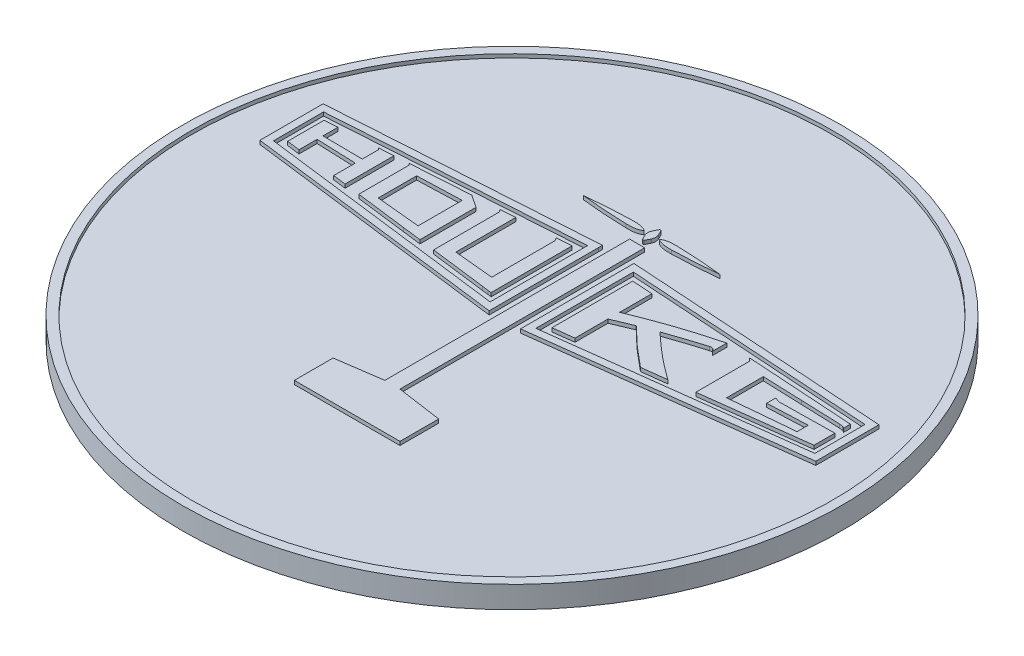
from build123d import *

# Parameters (mm, degrees)
SKETCH_3_R      = 36
SKETCH_3_R_2    = 35
EXTRUDE_2_DEPTH = 0.4
EXTRUDE_START   = 2
SKETCH_10_R     = 36
EXTRUDE_3_DEPTH = 2


with BuildPart() as part:
    # 草图3 → 凸台-拉伸2 (new body)
    # profile 1 of 14: a face of its own
    with BuildSketch(Plane(origin=(0, 0, 0), x_dir=(1, 0, 0), z_dir=(0, 1, 0))):
        with Locations(Location((0, 11.553808305, 0), (0, 0, 270))):
            Circle(SKETCH_3_R)
        with Locations(Location((0, 11.553808305, 0), (0, 0, 270))):
            Circle(SKETCH_3_R_2, mode=Mode.SUBTRACT)
    # profile 2 of 14: a face of its own
    with BuildSketch(Plane(origin=(0, 0, 0), x_dir=(1, 0, 0), z_dir=(0, 1, 0))):
        Polygon((0.86, -2.083132141), (-0.792362244, -2.083132141), (-0.792362244, -1.545326432), (-5.733618075, -2.256312599), (-5.733714019, -6.486617075), (0.033818878, -6.486617075), (5.801447721, -6.486617075), (5.801351776, -2.256312599), (0.86, -1.54532545), align=None)
    # profile 3 of 14: a face of its own
    with BuildSketch(Plane(origin=(0, 0, 0), x_dir=(1, 0, 0), z_dir=(0, 1, 0))):
        Polygon((-0.792362244, -1.545326432), (-0.792362244, -2.083132141), (0.86, -2.083132141), (0.86, -1.54532545), (0.481497558, -1.490864569), (0.033818878, -0.951366665), (-0.413859802, -1.490864569), align=None)
    # profile 4 of 14: a face of its own
    with BuildSketch(Plane(origin=(0, 0, 0), x_dir=(1, 0, 0), z_dir=(0, 1, 0))):
        Polygon((-0.792362244, 25.188808305), (-0.792362244, -1.545326432), (-0.413859802, -1.490864569), (0.033818878, -0.951366665), (0.481497558, -1.490864569), (0.86, -1.54532545), (0.86, 25.188808305), align=None)
    # profile 5 of 14: a face of its own
    with BuildSketch(Plane(origin=(0, 0, 0), x_dir=(1, 0, 0), z_dir=(0, 1, 0))):
        with BuildLine():
            add(Edge.make_bspline(
                [(-2.444724488, 26.454320905), (-4.192839694, 26.473701765), (-5.797421401, 26.62922837), (-7.401907164, 26.78485092)],
                knots=[0.6, 0.6, 0.6, 0.6, 1, 1, 1, 1], degree=3))
            add(Edge.make_bspline(
                [(-7.401907164, 26.78485092), (-5.797421401, 26.940377526), (-4.192839694, 27.096000076), (-2.444724488, 27.115284991)],
                knots=[0, 0, 0, 0, 0.2, 0.2, 0.2, 0.2], degree=3))
            add(Edge.make_bspline(
                [(-2.444724488, 27.115284991), (-1.851785301, 27.121905186), (-1.2423436, 27.112790425), (-0.792362244, 26.78485092)],
                knots=[0.2, 0.2, 0.2, 0.2, 0.4, 0.4, 0.4, 0.4], degree=3))
            add(Edge.make_bspline(
                [(-0.792362244, 26.78485092), (-1.2423436, 26.456911416), (-1.851785301, 26.447796655), (-2.444724488, 26.454320905)],
                knots=[0.4, 0.4, 0.4, 0.4, 0.6, 0.6, 0.6, 0.6], degree=3))
        make_face()
    # profile 6 of 14: a face of its own
    with BuildSketch(Plane(origin=(0, 0, 0), x_dir=(1, 0, 0), z_dir=(0, 1, 0))):
        with BuildLine():
            add(Edge.make_bspline(
                [(-30.327257972, 21.245858661), (-20.778730341, 21.870939372), (-11.230298655, 22.496116029), (-1.681866968, 23.121484575)],
                knots=[0.5, 0.5, 0.5, 0.5, 0.666666667, 0.666666667, 0.666666667, 0.666666667], degree=3))
            Line((-1.681866968, 23.121484575), (-1.681771023, 22.700094785))
            Line((-1.681771023, 22.700094785), (-1.676590001, 10.734140658))
            Line((-1.676590001, 10.734140658), (-30.327257972, 14.343394107))
            Line((-30.327257972, 14.343394107), (-30.327257972, 21.245858661))
        make_face()
        Polygon((-29.536192666, 15.037459167), (-2.464872907, 11.627195342), (-2.469478259, 22.278800939), (-29.536192666, 20.50650763), align=None, mode=Mode.SUBTRACT)
    # profile 7 of 14: a face of its own
    with BuildSketch(Plane(origin=(0, 0, 0), x_dir=(1, 0, 0), z_dir=(0, 1, 0))):
        with BuildLine():
            add(Edge.make_bspline(
                [(30.394895728, 14.343394107), (20.844737035, 13.140245661), (11.294482396, 11.937097215), (1.744227757, 10.734140658)],
                knots=[0.5, 0.5, 0.5, 0.5, 0.666666667, 0.666666667, 0.666666667, 0.666666667], degree=3))
            Line((1.744227757, 10.734140658), (1.744419647, 11.180668))
            Line((1.744419647, 11.180668), (1.749600669, 23.121484575))
            add(Edge.make_bspline(
                [(1.749600669, 23.121484575), (11.298032356, 22.496116029), (20.846464042, 21.870939372), (30.394895728, 21.245858661)],
                knots=[0.166666667, 0.166666667, 0.166666667, 0.166666667, 0.333333333, 0.333333333, 0.333333333, 0.333333333], degree=3))
            Line((30.394895728, 21.245858661), (30.394895728, 14.343394107))
        make_face()
        Polygon((29.603926367, 20.50650763), (2.537116016, 22.278800939), (2.532510663, 11.627195342), (29.603926367, 15.037459167), align=None, mode=Mode.SUBTRACT)
    # profile 8 of 14: a face of its own
    with BuildSketch(Plane(origin=(0, 0, 0), x_dir=(1, 0, 0), z_dir=(0, 1, 0))):
        with BuildLine():
            Line((-3.289614856, 12.558340133), (-3.289614856, 16.799294487))
            add(Edge.make_bspline(
                [(-3.289614856, 16.799294487), (-3.289614856, 18.333164839), (-3.289614856, 19.868762198), (-3.289614856, 21.403496053)],
                knots=[0.888888889, 0.888888889, 0.888888889, 0.888888889, 1, 1, 1, 1], degree=3))
            Line((-3.289614856, 21.403496053), (-4.904462662, 21.297764826))
            add(Edge.make_bspline(
                [(-4.904462662, 21.297764826), (-4.841043115, 21.179272933), (-4.777623568, 21.060781041), (-4.711613509, 20.943152652)],
                knots=[0.055555556, 0.055555556, 0.055555556, 0.055555556, 0.111111111, 0.111111111, 0.111111111, 0.111111111], degree=3))
            add(Edge.make_bspline(
                [(-4.711613509, 20.943152652), (-4.711613509, 19.794213047), (-4.711613509, 18.645273443), (-4.711613509, 17.497197342)],
                knots=[0.111111111, 0.111111111, 0.111111111, 0.111111111, 0.166666667, 0.166666667, 0.166666667, 0.166666667], degree=3))
            add(Edge.make_bspline(
                [(-4.711613509, 17.497197342), (-4.711613509, 16.348161793), (-4.711613509, 15.200181637), (-4.711613509, 14.052105536)],
                knots=[0.166666667, 0.166666667, 0.166666667, 0.166666667, 0.222222222, 0.222222222, 0.222222222, 0.222222222], degree=3))
            add(Edge.make_bspline(
                [(-4.711613509, 14.052105536), (-6.159325384, 14.191129626), (-7.604446747, 14.329194269), (-9.04956811, 14.467258911)],
                knots=[0.222222222, 0.222222222, 0.222222222, 0.222222222, 0.277777778, 0.277777778, 0.277777778, 0.277777778], degree=3))
            add(Edge.make_bspline(
                [(-9.04956811, 14.467258911), (-9.04956811, 15.562853178), (-9.04956811, 16.658447444), (-9.04956811, 17.753178208)],
                knots=[0.277777778, 0.277777778, 0.277777778, 0.277777778, 0.333333333, 0.333333333, 0.333333333, 0.333333333], degree=3))
            Line((-9.04956811, 17.753178208), (-9.04956811, 21.026432784))
            Line((-9.04956811, 21.026432784), (-10.6526147, 20.921373171))
            add(Edge.make_bspline(
                [(-10.6526147, 20.921373171), (-10.592265388, 20.822645918), (-10.531820131, 20.725357838), (-10.468976253, 20.62653464)],
                knots=[0.444444444, 0.444444444, 0.444444444, 0.444444444, 0.5, 0.5, 0.5, 0.5], degree=3))
            add(Edge.make_bspline(
                [(-10.468976253, 20.62653464), (-10.468976253, 19.430582058), (-10.468976253, 18.234629476), (-10.468976253, 17.039636342)],
                knots=[0.5, 0.5, 0.5, 0.5, 0.555555556, 0.555555556, 0.555555556, 0.555555556], degree=3))
            Line((-10.468976253, 17.039636342), (-10.468976253, 13.462716309))
            Line((-10.468976253, 13.462716309), (-4.37705381, 12.695349381))
            add(Edge.make_bspline(
                [(-4.37705381, 12.695349381), (-4.145251047, 12.666469981), (-3.913448284, 12.637494636), (-3.681645522, 12.60851929)],
                knots=[0.666666667, 0.666666667, 0.666666667, 0.666666667, 0.722222222, 0.722222222, 0.722222222, 0.722222222], degree=3))
            add(Edge.make_bspline(
                [(-3.681645522, 12.60851929), (-3.674449658, 12.607559842), (-3.667349739, 12.606408503), (-3.66005793, 12.604969331)],
                knots=[0.722222222, 0.722222222, 0.722222222, 0.722222222, 0.777777778, 0.777777778, 0.777777778, 0.777777778], degree=3))
            Line((-3.66005793, 12.604969331), (-3.289614856, 12.558340133))
        make_face()
    # profile 9 of 14: a face of its own
    with BuildSketch(Plane(origin=(0, 0, 0), x_dir=(1, 0, 0), z_dir=(0, 1, 0))):
        with BuildLine():
            add(Edge.make_bspline(
                [(-12.183126981, 16.743166749), (-12.183126981, 17.762292969), (-12.183126981, 18.783338085), (-12.183126981, 19.804383202)],
                knots=[0.7, 0.7, 0.7, 0.7, 0.8, 0.8, 0.8, 0.8], degree=3))
            add(Edge.make_bspline(
                [(-12.183126981, 19.804383202), (-12.644717665, 20.119657986), (-13.106308349, 20.429559858), (-13.567994977, 20.73053886)],
                knots=[0.8, 0.8, 0.8, 0.8, 1, 1, 1, 1], degree=3))
            Line((-13.567994977, 20.73053886), (-19.998890583, 20.309436904))
            add(Edge.make_bspline(
                [(-19.998890583, 20.309436904), (-19.942187175, 20.240068775), (-19.885195933, 20.170029033), (-19.826285794, 20.100852795)],
                knots=[0.1, 0.1, 0.1, 0.1, 0.2, 0.2, 0.2, 0.2], degree=3))
            add(Edge.make_bspline(
                [(-19.826285794, 20.100852795), (-19.826285794, 19.189376699), (-19.826285794, 18.277900604), (-19.826285794, 17.366424509)],
                knots=[0.2, 0.2, 0.2, 0.2, 0.3, 0.3, 0.3, 0.3], degree=3))
            Line((-19.826285794, 17.366424509), (-19.826285794, 14.641494762))
            Line((-19.826285794, 14.641494762), (-14.247284531, 13.93869872))
            add(Edge.make_bspline(
                [(-14.247284531, 13.93869872), (-13.55974372, 13.853019967), (-12.87181913, 13.767437159), (-12.183126981, 13.681950296)],
                knots=[0.5, 0.5, 0.5, 0.5, 0.6, 0.6, 0.6, 0.6], degree=3))
            add(Edge.make_bspline(
                [(-12.183126981, 13.681950296), (-12.183126981, 14.702035964), (-12.183126981, 15.723081081), (-12.183126981, 16.743166749)],
                knots=[0.6, 0.6, 0.6, 0.6, 0.7, 0.7, 0.7, 0.7], degree=3))
        make_face()
        with BuildLine():
            add(Edge.make_bspline(
                [(-13.59236497, 19.708630239), (-15.198865574, 19.653366004), (-16.802871613, 19.597238266), (-18.406781706, 19.541974031)],
                knots=[0.714285714, 0.714285714, 0.714285714, 0.714285714, 1, 1, 1, 1], degree=3))
            add(Edge.make_bspline(
                [(-18.406781706, 19.541974031), (-18.406781706, 18.844071177), (-18.406781706, 18.144441315), (-18.406781706, 17.44653846)],
                knots=[0, 0, 0, 0, 0.142857143, 0.142857143, 0.142857143, 0.142857143], degree=3))
            add(Edge.make_bspline(
                [(-18.406781706, 17.44653846), (-18.406781706, 16.74873155), (-18.406781706, 16.049869247), (-18.406781706, 15.351102889)],
                knots=[0.142857143, 0.142857143, 0.142857143, 0.142857143, 0.285714286, 0.285714286, 0.285714286, 0.285714286], degree=3))
            add(Edge.make_bspline(
                [(-18.406781706, 15.351102889), (-16.802871613, 15.196439787), (-15.198865574, 15.042736134), (-13.59236497, 14.887113584)],
                knots=[0.285714286, 0.285714286, 0.285714286, 0.285714286, 0.428571429, 0.428571429, 0.428571429, 0.428571429], degree=3))
            add(Edge.make_bspline(
                [(-13.59236497, 14.887113584), (-13.59236497, 15.689980107), (-13.59236497, 16.494573637), (-13.59236497, 17.29744016)],
                knots=[0.428571429, 0.428571429, 0.428571429, 0.428571429, 0.571428571, 0.571428571, 0.571428571, 0.571428571], degree=3))
            add(Edge.make_bspline(
                [(-13.59236497, 17.29744016), (-13.59236497, 18.100210738), (-13.59236497, 18.904900213), (-13.59236497, 19.708630239)],
                knots=[0.571428571, 0.571428571, 0.571428571, 0.571428571, 0.714285714, 0.714285714, 0.714285714, 0.714285714], degree=3))
        make_face(mode=Mode.SUBTRACT)
    # profile 10 of 14: a face of its own
    with BuildSketch(Plane(origin=(0, 0, 0), x_dir=(1, 0, 0), z_dir=(0, 1, 0))):
        with BuildLine():
            add(Edge.make_bspline(
                [(-27.297703321, 17.55706693), (-25.852677902, 17.502666199), (-24.407556539, 17.44653846), (-22.959844665, 17.392233674)],
                knots=[0.631578947, 0.631578947, 0.631578947, 0.631578947, 0.684210526, 0.684210526, 0.684210526, 0.684210526], degree=3))
            add(Edge.make_bspline(
                [(-22.959844665, 17.392233674), (-22.959844665, 16.996365214), (-22.959844665, 16.600496754), (-22.959844665, 16.205491797)],
                knots=[0.684210526, 0.684210526, 0.684210526, 0.684210526, 0.736842105, 0.736842105, 0.736842105, 0.736842105], degree=3))
            Line((-22.959844665, 16.205491797), (-22.959844665, 15.036211884))
            Line((-22.959844665, 15.036211884), (-21.540436522, 14.857466625))
            Line((-21.540436522, 14.857466625), (-21.540436522, 17.543250871))
            Line((-21.540436522, 17.543250871), (-21.540436522, 20.208502919))
            Line((-21.540436522, 20.208502919), (-23.122183355, 20.104882479))
            add(Edge.make_bspline(
                [(-23.122183355, 20.104882479), (-23.068838017, 20.046739898), (-23.015204845, 19.988501373), (-22.959844665, 19.929591234)],
                knots=[0.052631579, 0.052631579, 0.052631579, 0.052631579, 0.105263158, 0.105263158, 0.105263158, 0.105263158], degree=3))
            add(Edge.make_bspline(
                [(-22.959844665, 19.929591234), (-22.959844665, 19.634944593), (-22.959844665, 19.339434448), (-22.959844665, 19.044787807)],
                knots=[0.105263158, 0.105263158, 0.105263158, 0.105263158, 0.157894737, 0.157894737, 0.157894737, 0.157894737], degree=3))
            add(Edge.make_bspline(
                [(-22.959844665, 19.044787807), (-22.959844665, 18.750237111), (-22.959844665, 18.454631022), (-22.959844665, 18.160080326)],
                knots=[0.157894737, 0.157894737, 0.157894737, 0.157894737, 0.210526316, 0.210526316, 0.210526316, 0.210526316], degree=3))
            add(Edge.make_bspline(
                [(-22.959844665, 18.160080326), (-24.407556539, 18.173896384), (-25.852677902, 18.189535395), (-27.297703321, 18.203351454)],
                knots=[0.210526316, 0.210526316, 0.210526316, 0.210526316, 0.263157895, 0.263157895, 0.263157895, 0.263157895], degree=3))
            add(Edge.make_bspline(
                [(-27.297703321, 18.203351454), (-27.297703321, 18.483222588), (-27.297703321, 18.763093721), (-27.297703321, 19.042964855)],
                knots=[0.263157895, 0.263157895, 0.263157895, 0.263157895, 0.315789474, 0.315789474, 0.315789474, 0.315789474], degree=3))
            Line((-27.297703321, 19.042964855), (-27.297703321, 19.831535595))
            Line((-27.297703321, 19.831535595), (-28.717207408, 19.738565033))
            Line((-28.717207408, 19.738565033), (-28.717207408, 15.761554967))
            Line((-28.717207408, 15.761554967), (-27.297703321, 15.582713762))
            Line((-27.297703321, 15.582713762), (-27.297703321, 16.558089129))
            add(Edge.make_bspline(
                [(-27.297703321, 16.558089129), (-27.297703321, 16.890442097), (-27.297703321, 17.223754513), (-27.297703321, 17.55706693)],
                knots=[0.578947368, 0.578947368, 0.578947368, 0.578947368, 0.631578947, 0.631578947, 0.631578947, 0.631578947], degree=3))
        make_face()
    # profile 11 of 14: a face of its own
    with BuildSketch(Plane(origin=(0, 0, 0), x_dir=(1, 0, 0), z_dir=(0, 1, 0))):
        with BuildLine():
            add(Edge.make_bspline(
                [(3.356101274, 14.670470108), (3.356101274, 15.373362095), (3.356101274, 16.076254082), (3.356101274, 16.780873076)],
                knots=[0.875, 0.875, 0.875, 0.875, 0.916666667, 0.916666667, 0.916666667, 0.916666667], degree=3))
            Line((3.356101274, 16.780873076), (3.356101274, 18.644697774))
            Line((3.356101274, 18.644697774), (3.357348557, 21.384115193))
            add(Edge.make_bspline(
                [(3.357348557, 21.384115193), (4.099481988, 21.333552255), (4.846604552, 21.282989318), (5.59382306, 21.235112837)],
                knots=[0.041666667, 0.041666667, 0.041666667, 0.041666667, 0.083333333, 0.083333333, 0.083333333, 0.083333333], degree=3))
            add(Edge.make_bspline(
                [(5.59382306, 21.235112837), (5.59382306, 20.649369515), (5.59382306, 20.062762689), (5.59382306, 19.477019366)],
                knots=[0.083333333, 0.083333333, 0.083333333, 0.083333333, 0.125, 0.125, 0.125, 0.125], degree=3))
            add(Edge.make_bspline(
                [(5.59382306, 19.477019366), (5.59382306, 18.892139547), (5.59382306, 18.307355674), (5.59382306, 17.720748848)],
                knots=[0.125, 0.125, 0.125, 0.125, 0.166666667, 0.166666667, 0.166666667, 0.166666667], degree=3))
            add(Edge.make_bspline(
                [(5.59382306, 17.720748848), (7.053432096, 18.309082681), (8.494715665, 18.869976287), (9.972650168, 19.366970621)],
                knots=[0.166666667, 0.166666667, 0.166666667, 0.166666667, 0.208333333, 0.208333333, 0.208333333, 0.208333333], degree=3))
            add(Edge.make_bspline(
                [(9.972650168, 19.366970621), (11.413933737, 19.851588069), (12.894458751, 20.269523845), (14.356658297, 20.661746401)],
                knots=[0.208333333, 0.208333333, 0.208333333, 0.208333333, 0.25, 0.25, 0.25, 0.25], degree=3))
            add(Edge.make_bspline(
                [(14.356658297, 20.661746401), (14.356658297, 20.131938927), (14.356658297, 19.603954406), (14.356658297, 19.074146932)],
                knots=[0.25, 0.25, 0.25, 0.25, 0.291666667, 0.291666667, 0.291666667, 0.291666667], degree=3))
            add(Edge.make_bspline(
                [(14.356658297, 19.074146932), (14.298131938, 19.201945475), (14.22502196, 19.296834934), (14.135409468, 19.357184246)],
                knots=[0.291666667, 0.291666667, 0.291666667, 0.291666667, 0.333333333, 0.333333333, 0.333333333, 0.333333333], degree=3))
            add(Edge.make_bspline(
                [(14.135409468, 19.357184246), (14.041863238, 19.420220014), (13.898713518, 19.443918392), (13.741268016, 19.398056753)],
                knots=[0.333333333, 0.333333333, 0.333333333, 0.333333333, 0.375, 0.375, 0.375, 0.375], degree=3))
            add(Edge.make_bspline(
                [(13.741268016, 19.398056753), (12.362828325, 18.996623491), (11.012692365, 18.53983005), (9.652290307, 18.061544962)],
                knots=[0.375, 0.375, 0.375, 0.375, 0.416666667, 0.416666667, 0.416666667, 0.416666667], degree=3))
            add(Edge.make_bspline(
                [(9.652290307, 18.061544962), (10.061686991, 17.680739844), (10.471083675, 17.305403583), (10.880480359, 16.940621255)],
                knots=[0.416666667, 0.416666667, 0.416666667, 0.416666667, 0.458333333, 0.458333333, 0.458333333, 0.458333333], degree=3))
            add(Edge.make_bspline(
                [(10.880480359, 16.940621255), (11.289877043, 16.575838927), (11.701288569, 16.219307856), (12.121431077, 15.87294694)],
                knots=[0.458333333, 0.458333333, 0.458333333, 0.458333333, 0.5, 0.5, 0.5, 0.5], degree=3))
            add(Edge.make_bspline(
                [(12.121431077, 15.87294694), (12.931973188, 15.204882934), (13.769187968, 14.575484704), (14.595656924, 13.977364496)],
                knots=[0.5, 0.5, 0.5, 0.5, 0.541666667, 0.541666667, 0.541666667, 0.541666667], degree=3))
            add(Edge.make_bspline(
                [(14.595656924, 13.977364496), (13.710757553, 13.865492798), (12.828352747, 13.754580549), (11.943453376, 13.6436683)],
                knots=[0.541666667, 0.541666667, 0.541666667, 0.541666667, 0.583333333, 0.583333333, 0.583333333, 0.583333333], degree=3))
            add(Edge.make_bspline(
                [(11.943453376, 13.6436683), (11.24670186, 14.204561906), (10.539300465, 14.78262964), (9.853198827, 15.3928389)],
                knots=[0.583333333, 0.583333333, 0.583333333, 0.583333333, 0.625, 0.625, 0.625, 0.625], degree=3))
            add(Edge.make_bspline(
                [(9.853198827, 15.3928389), (9.148291998, 16.019742564), (8.46219036, 16.676197242), (7.768029355, 17.35596652)],
                knots=[0.625, 0.625, 0.625, 0.625, 0.666666667, 0.666666667, 0.666666667, 0.666666667], degree=3))
            add(Edge.make_bspline(
                [(7.768029355, 17.35596652), (7.043261942, 17.062183382), (6.318590474, 16.759573319), (5.59382306, 16.44717688)],
                knots=[0.666666667, 0.666666667, 0.666666667, 0.666666667, 0.708333333, 0.708333333, 0.708333333, 0.708333333], degree=3))
            add(Edge.make_bspline(
                [(5.59382306, 16.44717688), (5.59382306, 15.846370216), (5.59382306, 15.243740599), (5.59382306, 14.644756887)],
                knots=[0.708333333, 0.708333333, 0.708333333, 0.708333333, 0.75, 0.75, 0.75, 0.75], degree=3))
            add(Edge.make_bspline(
                [(5.59382306, 14.644756887), (5.59382306, 14.043950223), (5.59382306, 13.441320607), (5.59382306, 12.84224095)],
                knots=[0.75, 0.75, 0.75, 0.75, 0.791666667, 0.791666667, 0.791666667, 0.791666667], degree=3))
            add(Edge.make_bspline(
                [(5.59382306, 12.84224095), (4.846220772, 12.748214995), (4.098618484, 12.653229591), (3.356101274, 12.560930644)],
                knots=[0.791666667, 0.791666667, 0.791666667, 0.791666667, 0.833333333, 0.833333333, 0.833333333, 0.833333333], degree=3))
            add(Edge.make_bspline(
                [(3.356101274, 12.560930644), (3.356101274, 13.26382263), (3.356101274, 13.966714617), (3.356101274, 14.670470108)],
                knots=[0.833333333, 0.833333333, 0.833333333, 0.833333333, 0.875, 0.875, 0.875, 0.875], degree=3))
        make_face()
    # profile 12 of 14: a face of its own
    with BuildSketch(Plane(origin=(0, 0, 0), x_dir=(1, 0, 0), z_dir=(0, 1, 0))):
        with BuildLine():
            add(Edge.make_bspline(
                [(16.991016103, 20.505644126), (18.954143723, 20.377845583), (20.92235642, 20.250910544), (22.88548404, 20.123975504)],
                knots=[0.884615385, 0.884615385, 0.884615385, 0.884615385, 0.923076923, 0.923076923, 0.923076923, 0.923076923], degree=3))
            Line((22.88548404, 20.123975504), (23.883694282, 20.059500564))
            Line((23.883694282, 20.059500564), (28.784941109, 19.738565033))
            Line((28.784941109, 19.738565033), (28.784941109, 18.963138738))
            add(Edge.make_bspline(
                [(28.784941109, 18.963138738), (28.736584904, 19.03951084), (28.647644026, 19.091129171), (28.515336075, 19.119336957)],
                knots=[0.076923077, 0.076923077, 0.076923077, 0.076923077, 0.115384615, 0.115384615, 0.115384615, 0.115384615], degree=3))
            add(Edge.make_bspline(
                [(28.515336075, 19.119336957), (28.38571458, 19.14706502), (28.268757805, 19.164431038), (28.16446575, 19.168172887)],
                knots=[0.115384615, 0.115384615, 0.115384615, 0.115384615, 0.153846154, 0.153846154, 0.153846154, 0.153846154], degree=3))
            add(Edge.make_bspline(
                [(28.16446575, 19.168172887), (26.722702457, 19.219503383), (25.283337785, 19.271025769), (23.841574492, 19.323507603)],
                knots=[0.153846154, 0.153846154, 0.153846154, 0.153846154, 0.192307692, 0.192307692, 0.192307692, 0.192307692], degree=3))
            add(Edge.make_bspline(
                [(23.841574492, 19.323507603), (22.404800331, 19.375797547), (20.963037037, 19.42904694), (19.52376831, 19.481432829)],
                knots=[0.192307692, 0.192307692, 0.192307692, 0.192307692, 0.230769231, 0.230769231, 0.230769231, 0.230769231], degree=3))
            add(Edge.make_bspline(
                [(19.52376831, 19.481432829), (19.52376831, 18.811449927), (19.52376831, 18.141371079), (19.52376831, 17.47225168)],
                knots=[0.230769231, 0.230769231, 0.230769231, 0.230769231, 0.269230769, 0.269230769, 0.269230769, 0.269230769], degree=3))
            add(Edge.make_bspline(
                [(19.52376831, 17.47225168), (19.52376831, 16.803036337), (19.52376831, 16.132093986), (19.52376831, 15.462974587)],
                knots=[0.269230769, 0.269230769, 0.269230769, 0.269230769, 0.307692308, 0.307692308, 0.307692308, 0.307692308], degree=3))
            add(Edge.make_bspline(
                [(19.52376831, 15.462974587), (20.668006617, 15.573023332), (21.819824567, 15.682400464), (22.961760198, 15.791393816)],
                knots=[0.307692308, 0.307692308, 0.307692308, 0.307692308, 0.346153846, 0.346153846, 0.346153846, 0.346153846], degree=3))
            add(Edge.make_bspline(
                [(22.961760198, 15.791393816), (24.10849307, 15.900770947), (25.430900968, 16.009668354), (26.577729786, 16.118853596)],
                knots=[0.346153846, 0.346153846, 0.346153846, 0.346153846, 0.384615385, 0.384615385, 0.384615385, 0.384615385], degree=3))
            add(Edge.make_bspline(
                [(26.577729786, 16.118853596), (26.577729786, 16.320241841), (26.577729786, 16.522589534), (26.577729786, 16.725896676)],
                knots=[0.384615385, 0.384615385, 0.384615385, 0.384615385, 0.423076923, 0.423076923, 0.423076923, 0.423076923], degree=3))
            add(Edge.make_bspline(
                [(26.577729786, 16.725896676), (26.577729786, 16.928244369), (26.577729786, 17.130592062), (26.577729786, 17.33284381)],
                knots=[0.423076923, 0.423076923, 0.423076923, 0.423076923, 0.461538462, 0.461538462, 0.461538462, 0.461538462], degree=3))
            add(Edge.make_bspline(
                [(26.577729786, 17.33284381), (25.181636242, 17.272494498), (23.617831097, 17.211281683), (22.22682263, 17.149205363)],
                knots=[0.461538462, 0.461538462, 0.461538462, 0.461538462, 0.5, 0.5, 0.5, 0.5], degree=3))
            add(Edge.make_bspline(
                [(22.22682263, 17.149205363), (22.22682263, 17.477528647), (22.22682263, 17.80681138), (22.22682263, 18.135134664)],
                knots=[0.5, 0.5, 0.5, 0.5, 0.538461538, 0.538461538, 0.538461538, 0.538461538], degree=3))
            add(Edge.make_bspline(
                [(22.22682263, 18.135134664), (22.402305765, 18.072194841), (22.580283465, 18.011845529), (22.758261166, 17.950536768)],
                knots=[0.538461538, 0.538461538, 0.538461538, 0.538461538, 0.576923077, 0.576923077, 0.576923077, 0.576923077], degree=3))
            add(Edge.make_bspline(
                [(22.758261166, 17.950536768), (24.708724066, 17.981622901), (26.831983644, 18.011845529), (28.784941109, 18.041972213)],
                knots=[0.576923077, 0.576923077, 0.576923077, 0.576923077, 0.615384615, 0.615384615, 0.615384615, 0.615384615], degree=3))
            Line((28.784941109, 18.041972213), (28.784941109, 15.761554967))
            Line((28.784941109, 15.761554967), (17.316556986, 14.316817383))
            Line((17.316556986, 14.316817383), (17.316556986, 15.791393816))
            add(Edge.make_bspline(
                [(17.316556986, 15.791393816), (17.316556986, 16.282151734), (17.316556986, 16.77463666), (17.316556986, 17.267217531)],
                knots=[0.730769231, 0.730769231, 0.730769231, 0.730769231, 0.769230769, 0.769230769, 0.769230769, 0.769230769], degree=3))
            add(Edge.make_bspline(
                [(17.316556986, 17.267217531), (17.316556986, 17.75797545), (17.316556986, 18.250556321), (17.316556986, 18.74131424)],
                knots=[0.769230769, 0.769230769, 0.769230769, 0.769230769, 0.807692308, 0.807692308, 0.807692308, 0.807692308], degree=3))
            add(Edge.make_bspline(
                [(17.316556986, 18.74131424), (17.316556986, 19.232072159), (17.316556986, 19.725516533), (17.316556986, 20.217137956)],
                knots=[0.807692308, 0.807692308, 0.807692308, 0.807692308, 0.846153846, 0.846153846, 0.846153846, 0.846153846], degree=3))
            add(Edge.make_bspline(
                [(17.316556986, 20.217137956), (17.207179855, 20.312123359), (17.097802724, 20.407972267), (16.991016103, 20.505644126)],
                knots=[0.846153846, 0.846153846, 0.846153846, 0.846153846, 0.884615385, 0.884615385, 0.884615385, 0.884615385], degree=3))
        make_face()
    # profile 13 of 14: a face of its own
    with BuildSketch(Plane(origin=(0, 0, 0), x_dir=(1, 0, 0), z_dir=(0, 1, 0))):
        with BuildLine():
            Line((-0.076325812, 27.666104387), (-0.310431251, 27.197893509))
            add(Edge.make_bspline(
                [(-0.310431251, 27.197893509), (-0.433528497, 26.951603073), (-0.433528497, 26.618098767), (-0.310431251, 26.371712387)],
                knots=[0.090909091, 0.090909091, 0.090909091, 0.090909091, 0.181818182, 0.181818182, 0.181818182, 0.181818182], degree=3))
            Line((-0.310431251, 26.371712387), (-0.076325812, 25.903501508))
            add(Edge.make_bspline(
                [(-0.076325812, 25.903501508), (-0.055409834, 25.861861443), (-0.01281032, 25.835476608), (0.033818878, 25.835476608)],
                knots=[0.272727273, 0.272727273, 0.272727273, 0.272727273, 0.363636364, 0.363636364, 0.363636364, 0.363636364], degree=3))
            add(Edge.make_bspline(
                [(0.033818878, 25.835476608), (0.080544021, 25.835476608), (0.123143535, 25.861861443), (0.143963568, 25.903501508)],
                knots=[0.363636364, 0.363636364, 0.363636364, 0.363636364, 0.454545455, 0.454545455, 0.454545455, 0.454545455], degree=3))
            Line((0.143963568, 25.903501508), (0.378069008, 26.371712387))
            add(Edge.make_bspline(
                [(0.378069008, 26.371712387), (0.501262198, 26.618098767), (0.501262198, 26.951603073), (0.378069008, 27.197893509)],
                knots=[0.545454545, 0.545454545, 0.545454545, 0.545454545, 0.636363636, 0.636363636, 0.636363636, 0.636363636], degree=3))
            Line((0.378069008, 27.197893509), (0.143963568, 27.666104387))
            add(Edge.make_bspline(
                [(0.143963568, 27.666104387), (0.123143535, 27.707840398), (0.080544021, 27.734225232), (0.033818878, 27.734225232)],
                knots=[0.727272727, 0.727272727, 0.727272727, 0.727272727, 0.818181818, 0.818181818, 0.818181818, 0.818181818], degree=3))
            add(Edge.make_bspline(
                [(0.033818878, 27.734225232), (-0.01281032, 27.734225232), (-0.055409834, 27.707840398), (-0.076325812, 27.666104387)],
                knots=[0.818181818, 0.818181818, 0.818181818, 0.818181818, 1, 1, 1, 1], degree=3))
        make_face()
    # profile 14 of 14: a face of its own
    with BuildSketch(Plane(origin=(0, 0, 0), x_dir=(1, 0, 0), z_dir=(0, 1, 0))):
        with BuildLine():
            add(Edge.make_bspline(
                [(2.512458189, 27.115284991), (1.919519002, 27.121905186), (1.310077301, 27.112790425), (0.860095945, 26.78485092)],
                knots=[0.2, 0.2, 0.2, 0.2, 0.4, 0.4, 0.4, 0.4], degree=3))
            add(Edge.make_bspline(
                [(0.860095945, 26.78485092), (1.310077301, 26.456911416), (1.919519002, 26.447796655), (2.512458189, 26.454320905)],
                knots=[0.4, 0.4, 0.4, 0.4, 0.6, 0.6, 0.6, 0.6], degree=3))
            add(Edge.make_bspline(
                [(2.512458189, 26.454320905), (4.260573395, 26.473701765), (5.865059158, 26.62922837), (7.469640865, 26.78485092)],
                knots=[0.6, 0.6, 0.6, 0.6, 1, 1, 1, 1], degree=3))
            add(Edge.make_bspline(
                [(7.469640865, 26.78485092), (5.865059158, 26.940377526), (4.260573395, 27.096000076), (2.512458189, 27.115284991)],
                knots=[0, 0, 0, 0, 0.2, 0.2, 0.2, 0.2], degree=3))
        make_face()
    extrude(amount=EXTRUDE_2_DEPTH)

    # 草图10 → 凸台-拉伸3 (add)
    with BuildSketch(Plane.XZ.offset(EXTRUDE_START)):
        with Locations(Location((0, -11.553808305, 0), (0, 0, 270))):
            Circle(SKETCH_10_R)
    extrude(amount=-EXTRUDE_3_DEPTH)


solid = part.part
